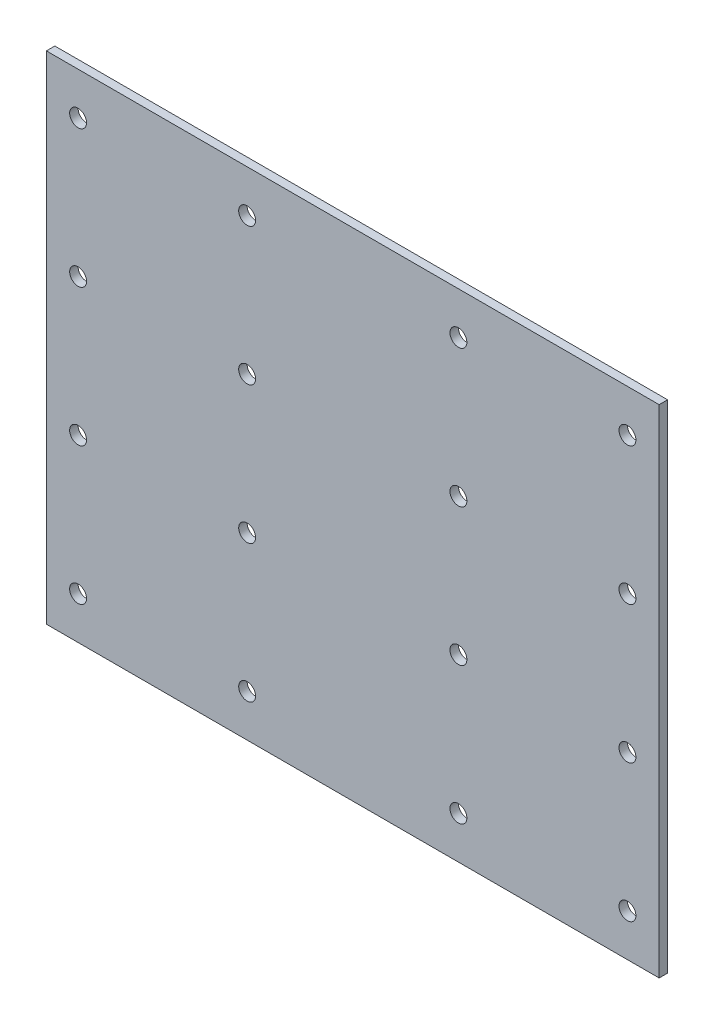
from build123d import *

# Parameters (mm, degrees)
SKETCH1_W                 = 184.15
SKETCH1_H                 = 149.225
BOSS_EXTRUDE1_DEPTH       = 2.54
SKETCH2_R                 = 2.54
CUT_EXTRUDE1_DEPTH        = 2.54
LPATTERN1_COUNT           = 2
LPATTERN1_PITCH           = 50.8
LPATTERN2_COUNT           = 2
LPATTERN2_PITCH           = 41.275
LPATTERN2_COPY_1_SKETCH_R = 2.54
LPATTERN2_COPY_1_DEPTH    = 2.54
SKETCH3_R                 = 2.54
CUT_EXTRUDE2_DEPTH        = 2.54
LPATTERN3_COUNT           = 2
LPATTERN3_PITCH           = 50.8
LPATTERN4_COUNT           = 2
LPATTERN4_PITCH           = 41.275
LPATTERN4_COPY_1_SKETCH_R = 2.54
LPATTERN4_COPY_1_DEPTH    = 2.54
SKETCH5_R                 = 2.54
CUT_EXTRUDE4_DEPTH        = 2.54
LPATTERN7_COUNT           = 2
LPATTERN7_PITCH           = 41.275
LPATTERN8_COUNT           = 2
LPATTERN8_PITCH           = 50.8
LPATTERN8_COPY_1_SKETCH_R = 2.54
LPATTERN8_COPY_1_DEPTH    = 2.54
LPATTERN9_COUNT           = 2
LPATTERN9_PITCH           = 82.55
LPATTERN9_COPY_1_SKETCH_R = 2.54
LPATTERN9_COPY_1_DEPTH    = 2.54
LPATTERN9_COPY_2_SKETCH_R = 2.54
LPATTERN9_COPY_2_DEPTH    = 2.54
LPATTERN9_COPY_3_SKETCH_R = 2.54
LPATTERN9_COPY_3_DEPTH    = 2.54


with BuildPart() as part:
    # Sketch1 → Boss-Extrude1 (new body)
    with BuildSketch(Plane.XY):
        with Locations((92.075, -74.6125)):
            Rectangle(SKETCH1_W, SKETCH1_H)
    extrude(amount=BOSS_EXTRUDE1_DEPTH)

    # Sketch2 → Cut-Extrude1 (cut)
    with BuildSketch(Plane.XY.offset(2.54)):
        with Locations((9.525, -12.7)):
            Circle(SKETCH2_R)
    cut_extrude1 = extrude(amount=-CUT_EXTRUDE1_DEPTH, mode=Mode.SUBTRACT)

    # LPattern1: Cut-Extrude1 ×2
    with Locations(*[(i * LPATTERN1_PITCH, 0, 0) for i in range(1, LPATTERN1_COUNT)]):
        add(cut_extrude1, mode=Mode.SUBTRACT)

    # LPattern2: Cut-Extrude1 ×2
    with Locations(*[(0, -i * LPATTERN2_PITCH, 0) for i in range(1, LPATTERN2_COUNT)]):
        add(cut_extrude1, mode=Mode.SUBTRACT)

    # LPattern2 copy 1 sketch → LPattern2 copy 1 (cut)
    with BuildSketch(Plane(origin=(50.8, -41.275, 2.54), x_dir=(1, 0, 0), z_dir=(0, 0, 1))):
        with Locations((9.525, -12.7)):
            Circle(LPATTERN2_COPY_1_SKETCH_R)
    extrude(amount=-LPATTERN2_COPY_1_DEPTH, mode=Mode.SUBTRACT)

    # Sketch3 → Cut-Extrude2 (cut)
    with BuildSketch(Plane.XY.offset(2.54)):
        with Locations((123.825, -12.7)):
            Circle(SKETCH3_R)
    cut_extrude2 = extrude(amount=-CUT_EXTRUDE2_DEPTH, mode=Mode.SUBTRACT)

    # LPattern3: Cut-Extrude2 ×2
    with Locations(*[(i * LPATTERN3_PITCH, 0, 0) for i in range(1, LPATTERN3_COUNT)]):
        add(cut_extrude2, mode=Mode.SUBTRACT)

    # LPattern4: Cut-Extrude2 ×2
    with Locations(*[(0, -i * LPATTERN4_PITCH, 0) for i in range(1, LPATTERN4_COUNT)]):
        add(cut_extrude2, mode=Mode.SUBTRACT)

    # LPattern4 copy 1 sketch → LPattern4 copy 1 (cut)
    with BuildSketch(Plane(origin=(50.8, -41.275, 2.54), x_dir=(1, 0, 0), z_dir=(0, 0, 1))):
        with Locations((123.825, -12.7)):
            Circle(LPATTERN4_COPY_1_SKETCH_R)
    extrude(amount=-LPATTERN4_COPY_1_DEPTH, mode=Mode.SUBTRACT)

    # Sketch5 → Cut-Extrude4 (cut)
    with BuildSketch(Plane.XY.offset(2.54)):
        with Locations((9.525, -136.525)):
            Circle(SKETCH5_R)
    cut_extrude4 = extrude(amount=-CUT_EXTRUDE4_DEPTH, mode=Mode.SUBTRACT)

    # LPattern7: Cut-Extrude4 ×2
    with Locations(*[(0, i * LPATTERN7_PITCH, 0) for i in range(1, LPATTERN7_COUNT)]):
        add(cut_extrude4, mode=Mode.SUBTRACT)

    # LPattern8: Cut-Extrude4 ×2
    with Locations(*[(i * LPATTERN8_PITCH, 0, 0) for i in range(1, LPATTERN8_COUNT)]):
        add(cut_extrude4, mode=Mode.SUBTRACT)

    # LPattern8 copy 1 sketch → LPattern8 copy 1 (cut)
    with BuildSketch(Plane(origin=(50.8, 41.275, 2.54), x_dir=(1, 0, 0), z_dir=(0, 0, 1))):
        with Locations((9.525, -136.525)):
            Circle(LPATTERN8_COPY_1_SKETCH_R)
    extrude(amount=-LPATTERN8_COPY_1_DEPTH, mode=Mode.SUBTRACT)

    # LPattern9: Cut-Extrude2 ×2
    with Locations(*[(0, -i * LPATTERN9_PITCH, 0) for i in range(1, LPATTERN9_COUNT)]):
        add(cut_extrude2, mode=Mode.SUBTRACT)

    # LPattern9 copy 1 sketch → LPattern9 copy 1 (cut)
    with BuildSketch(Plane(origin=(50.8, -82.55, 2.54), x_dir=(1, 0, 0), z_dir=(0, 0, 1))):
        with Locations((123.825, -12.7)):
            Circle(LPATTERN9_COPY_1_SKETCH_R)
    extrude(amount=-LPATTERN9_COPY_1_DEPTH, mode=Mode.SUBTRACT)

    # LPattern9 copy 2 sketch → LPattern9 copy 2 (cut)
    with BuildSketch(Plane(origin=(0, -123.825, 2.54), x_dir=(1, 0, 0), z_dir=(0, 0, 1))):
        with Locations((123.825, -12.7)):
            Circle(LPATTERN9_COPY_2_SKETCH_R)
    extrude(amount=-LPATTERN9_COPY_2_DEPTH, mode=Mode.SUBTRACT)

    # LPattern9 copy 3 sketch → LPattern9 copy 3 (cut)
    with BuildSketch(Plane(origin=(50.8, -123.825, 2.54), x_dir=(1, 0, 0), z_dir=(0, 0, 1))):
        with Locations((123.825, -12.7)):
            Circle(LPATTERN9_COPY_3_SKETCH_R)
    extrude(amount=-LPATTERN9_COPY_3_DEPTH, mode=Mode.SUBTRACT)


solid = part.part
